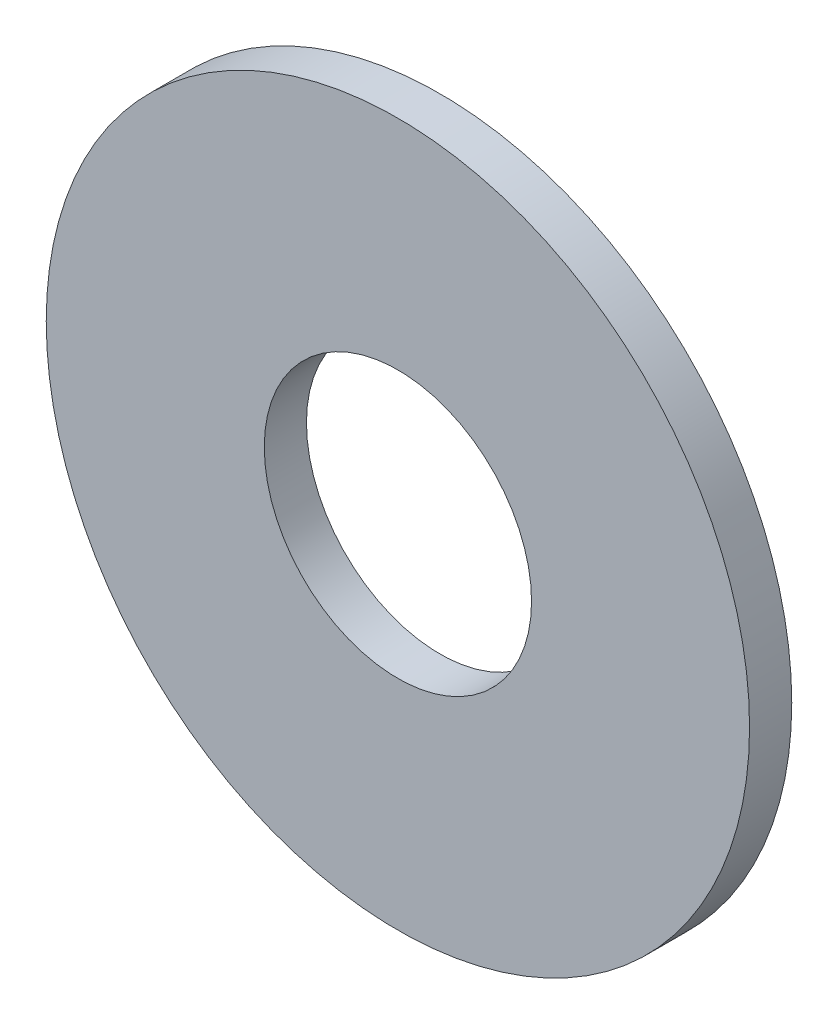
from build123d import *

# Parameters (mm, degrees)
SKETCH1_R           = 25
SKETCH1_R_2         = 9.5
BOSS_EXTRUDE1_DEPTH = 3


with BuildPart() as part:
    # Sketch1 → Boss-Extrude1 (new body)
    with BuildSketch(Plane.XY):
        Circle(SKETCH1_R)
        Circle(SKETCH1_R_2, mode=Mode.SUBTRACT)
    extrude(amount=BOSS_EXTRUDE1_DEPTH)


solid = part.part
